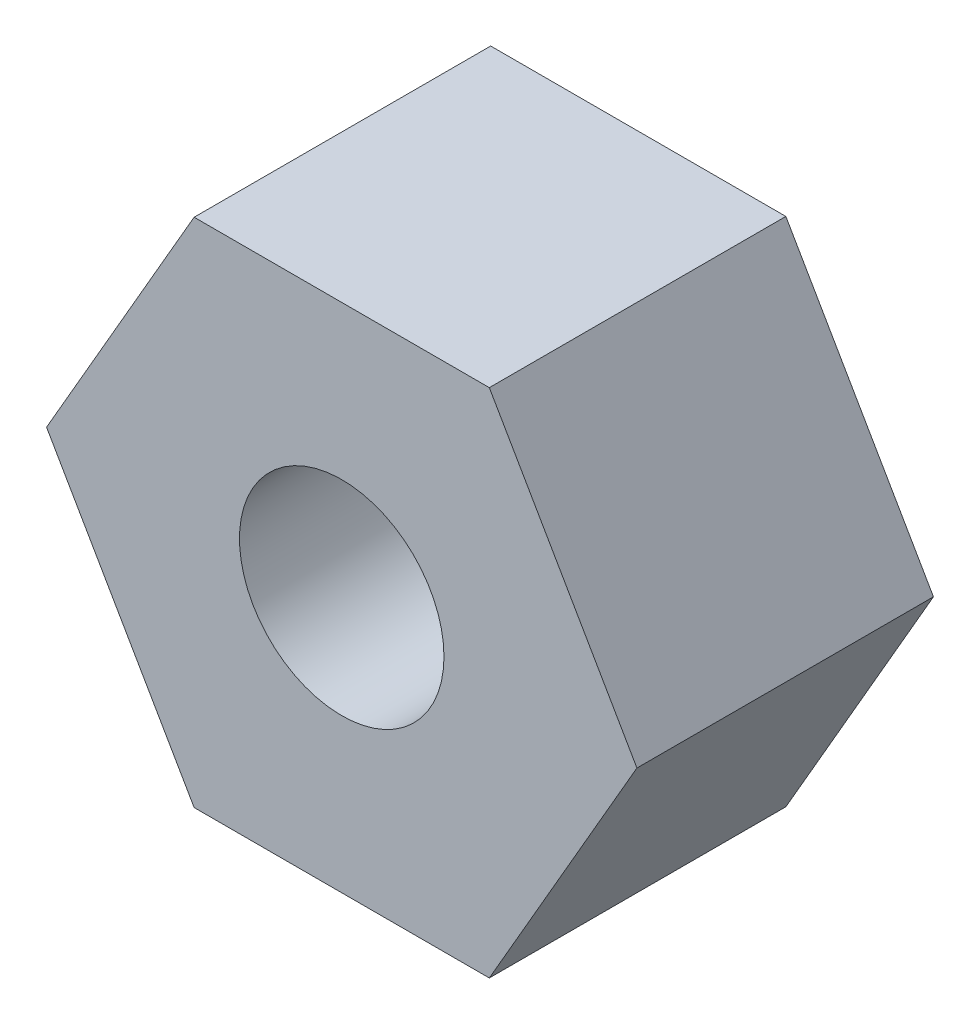
from build123d import *

# Parameters (mm, degrees)
SKETCH_1_R      = 2
EXTRUDE_1_DEPTH = 5.8


with BuildPart() as part:
    # 草图1 → 凸台-拉伸1 (new body)
    with BuildSketch(Plane.XY):
        Polygon((2.886751346, -5), (5.773502692, 0), (2.886751346, 5), (-2.886751346, 5), (-5.773502692, 0), (-2.886751346, -5), align=None)
        Circle(SKETCH_1_R, mode=Mode.SUBTRACT)
    extrude(amount=EXTRUDE_1_DEPTH)


solid = part.part
